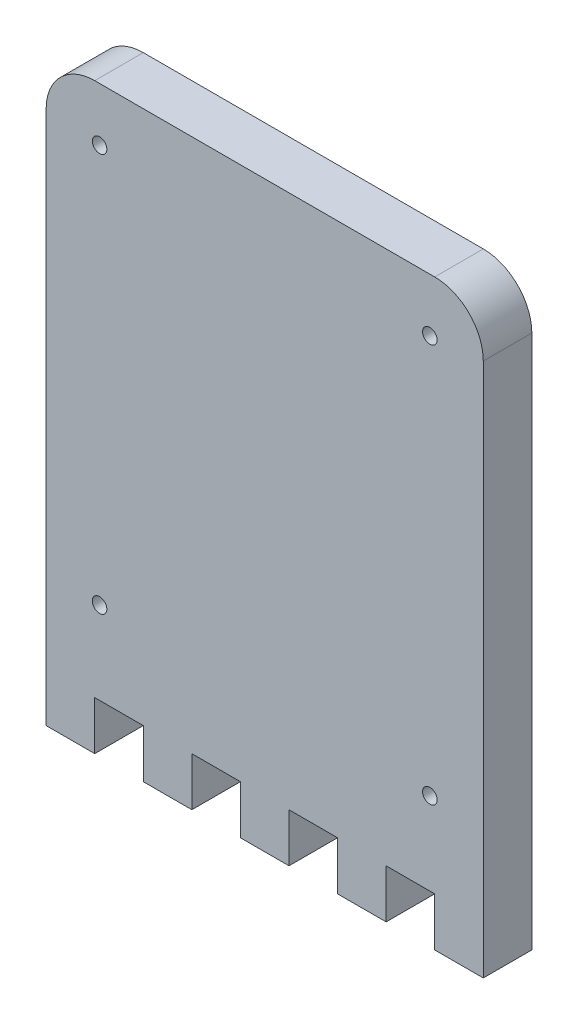
from build123d import *

# Parameters (mm, degrees)
EXTRUDE_2_DEPTH     = 5
SKETCH_3_R          = 1.5
CUT_EXTRUDE_1_DEPTH = 10


with BuildPart() as part:
    # Эскиз1 → Бобышка-Вытянуть2 (new, symmetric)
    with BuildSketch(Plane.XY):
        with BuildLine():
            Line((-15, -55), (-15, -65))
            Line((-15, -65), (-25, -65))
            Line((-25, -65), (-25, -55))
            Line((-25, -55), (-35, -55))
            Line((-35, -55), (-35, -65))
            Line((-35, -65), (-45, -65))
            Line((-45, -65), (-45, -55))
            Line((-45, -55), (-45, 45))
            ThreePointArc((-45, 45), (-42.071067812, 52.071067812), (-35, 55))
            Line((-35, 55), (35, 55))
            ThreePointArc((35, 55), (42.071067812, 52.071067812), (45, 45))
            Line((45, 45), (45, -55))
            Line((45, -55), (45, -65))
            Line((45, -65), (35, -65))
            Line((35, -65), (35, -55))
            Line((35, -55), (25, -55))
            Line((25, -55), (25, -65))
            Line((25, -65), (15, -65))
            Line((15, -65), (15, -55))
            Line((15, -55), (5, -55))
            Line((5, -55), (5, -65))
            Line((5, -65), (-5, -65))
            Line((-5, -65), (-5, -55))
            Line((-5, -55), (-15, -55))
        make_face()
    extrude(amount=EXTRUDE_2_DEPTH, both=True)

    # Эскиз3 → Вырез-Вытянуть1 (cut)
    with BuildSketch(Plane.XY.offset(5)):
        with Locations((-34, 44)):
            Circle(SKETCH_3_R)
        with Locations((34, 44)):
            Circle(SKETCH_3_R)
        with Locations((34, -38)):
            Circle(SKETCH_3_R)
        with Locations((-34, -38)):
            Circle(SKETCH_3_R)
    extrude(amount=-CUT_EXTRUDE_1_DEPTH, mode=Mode.SUBTRACT)


solid = part.part
